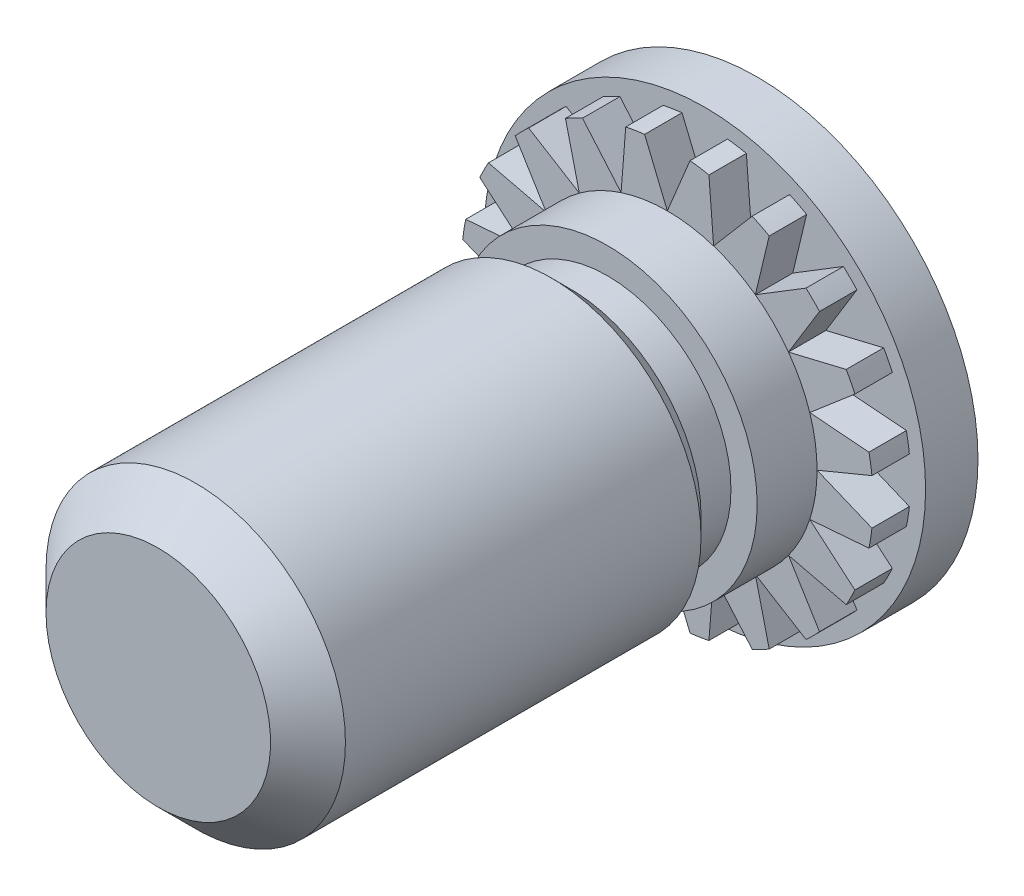
from build123d import *

# Parameters (mm, degrees)
SKETCH_1_R               = 2.95
EXTRUDE_1_DEPTH          = 1.2
SKETCH_2_R               = 2
EXTRUDE_2_DEPTH          = 1.9
CUT_EXTRUDE_1_DEPTH      = 0.5
PATTERN_CIRCULAR_1_COUNT = 20
SKETCH_4_W               = 0.35
SKETCH_4_H               = 0.5
SKETCH_6_W               = 4.9
SKETCH_6_H               = 2
CHAMFER_2_SIZE           = 0.5
CUT_EXTRUDE_START        = -0.5
SKETCH_7_R               = 2.95
SKETCH_7_R_2             = 2.75
CUT_EXTRUDE_2_DEPTH      = 0.5
CHAMFER_3_SIZE           = 0.25


with BuildPart() as part:
    # Эскиз1 → Вытянуть1 (new body)
    with BuildSketch(Plane.XY):
        Circle(SKETCH_1_R)
    extrude(amount=EXTRUDE_1_DEPTH)

    # Эскиз2 → Вытянуть2 (add)
    with BuildSketch(Plane.XY.offset(1.2)):
        with Locations(Location((0, 0, 0), (0, 0, 180))):
            Circle(SKETCH_2_R)
    extrude(amount=EXTRUDE_2_DEPTH)

    # Эскиз3 → Вырез-Вытянуть1 (cut)
    with BuildSketch(Plane.XY.offset(1.2)):
        Polygon((-0.393502884, 2.95), (0.393502884, 2.95), (0, 2), align=None)
    cut_extrude_1 = extrude(amount=-CUT_EXTRUDE_1_DEPTH, mode=Mode.SUBTRACT)

    # Круговой массив1: Вырез-Вытянуть1 ×20 about axis
    pattern_circular_1_axis = Axis((0, 0, 0), (0, 0, 1))
    for i in range(1, PATTERN_CIRCULAR_1_COUNT):
        add(cut_extrude_1.rotate(pattern_circular_1_axis, i * 360 / PATTERN_CIRCULAR_1_COUNT), mode=Mode.SUBTRACT)

    # Эскиз4 → Вырез-Повернуть1 (revolve, cut)
    with BuildSketch(Plane(origin=(0, 0, 0), x_dir=(1, 0, 0), z_dir=(0, 1, 0)), mode=Mode.PRIVATE) as cut_revolve_1_sk:
        with Locations((1.825, -2.25)):
            Rectangle(SKETCH_4_W, SKETCH_4_H)
    revolve(cut_revolve_1_sk.sketch.rotate(Axis((0, 0, 10.642619983), (0, 0, -1)), 172.537215717), axis=Axis((0, 0, 10.642619983), (0, 0, -1)), mode=Mode.SUBTRACT)

    # Эскиз6 → Повернуть1 (revolve)
    with BuildSketch(Plane(origin=(0, 0, 0), x_dir=(0, 0, -1), z_dir=(1, 0, 0)), mode=Mode.PRIVATE) as revolve_1_sk:
        with Locations((-5.55, -1)):
            Rectangle(SKETCH_6_W, SKETCH_6_H)
    revolve(revolve_1_sk.sketch.rotate(Axis((0, 0, 3.1), (0, 0, 1)), 277.462784283), axis=Axis((0, 0, 3.1), (0, 0, 1)))

    # Фаска2
    chamfer_2_edges = [part.edges().sort_by_distance(p)[0] for p in [
        (1.983058868, 0.25976437, 8),
    ]]
    chamfer(chamfer_2_edges, length=CHAMFER_2_SIZE)

    # Эскиз7 → Вырез-Вытянуть2 (cut)
    with BuildSketch(Plane.XY.offset(1.2).offset(CUT_EXTRUDE_START)):
        with Locations(Location((0, 0, 0), (0, 0, 180))):
            Circle(SKETCH_7_R)
        Circle(SKETCH_7_R_2, mode=Mode.SUBTRACT)
    extrude(amount=CUT_EXTRUDE_2_DEPTH, mode=Mode.SUBTRACT)

    # Фаска3
    chamfer_3_edges = [part.edges().sort_by_distance(p)[0] for p in [
        (2, 0, 2.5),
    ]]
    chamfer(chamfer_3_edges, length=CHAMFER_3_SIZE)


solid = part.part
